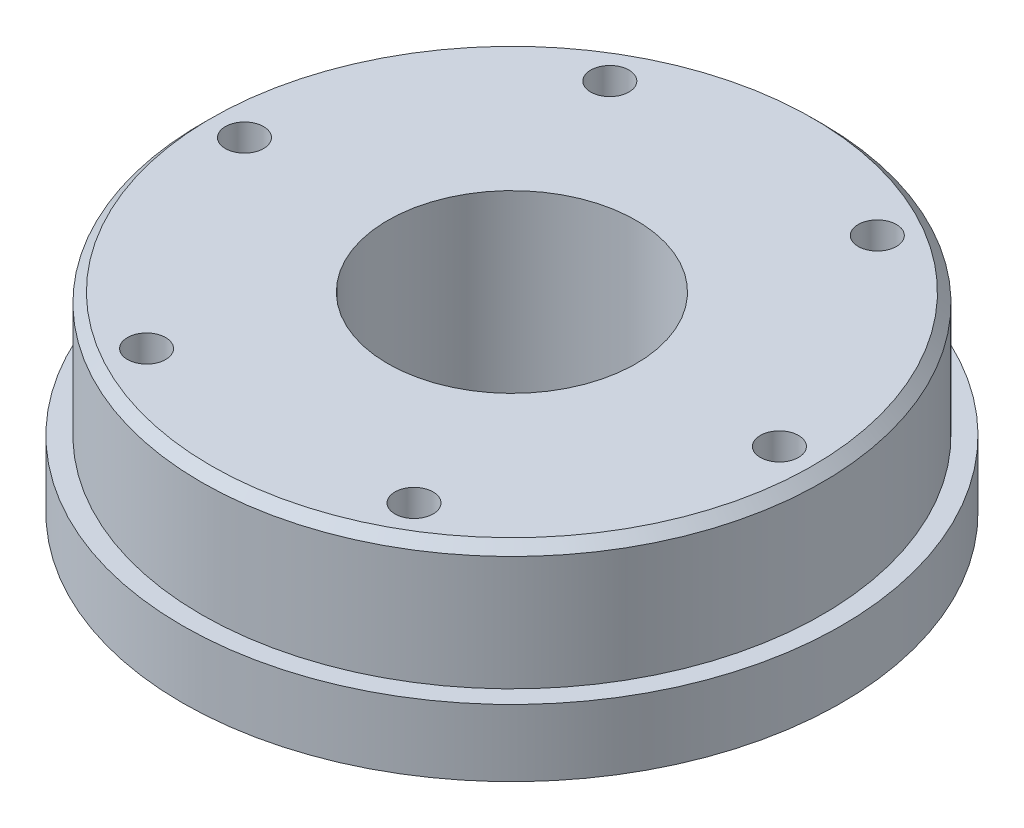
from build123d import *

# Parameters (mm, degrees)
SKETCH_1_R          = 34.5
EXTRUDE_1_DEPTH     = 20
CUT_EXTRUDE_START   = -13
SKETCH_2_R          = 34.5
SKETCH_2_R_2        = 32.5
CUT_EXTRUDE_1_DEPTH = 13
SKETCH_3_R          = 2
CUT_EXTRUDE_3_DEPTH = 53.730446613
SKETCH_7_R          = 13
CUT_EXTRUDE_6_DEPTH = 53.730446613
SKETCH_8_R          = 3.75
CUT_EXTRUDE_7_DEPTH = 4.5
CHAMFER_4_SIZE      = 1
SKETCH_9_R          = 2
CUT_EXTRUDE_8_DEPTH = 10


with BuildPart() as part:
    # 草图1 → 凸台-拉伸1 (new body)
    with BuildSketch(Plane(origin=(0, 0, 0), x_dir=(1, 0, 0), z_dir=(0, 1, 0))):
        Circle(SKETCH_1_R)
    extrude(amount=EXTRUDE_1_DEPTH)

    # 草图2 → 切除-拉伸1 (cut)
    with BuildSketch(Plane(origin=(0, 20, 0), x_dir=(1, 0, 0), z_dir=(0, 1, 0)).offset(CUT_EXTRUDE_START)):
        Circle(SKETCH_2_R)
        Circle(SKETCH_2_R_2, mode=Mode.SUBTRACT)
    extrude(amount=CUT_EXTRUDE_1_DEPTH, mode=Mode.SUBTRACT)

    # 草图3 → 切除-拉伸3 (cut, through all)
    with BuildSketch(Plane(origin=(0, 20, 0), x_dir=(1, 0, 0), z_dir=(0, 1, 0))):
        with Locations((-28, 0)):
            Circle(SKETCH_3_R)
        with Locations((-14, 24.248711306)):
            Circle(SKETCH_3_R)
        with Locations((14, 24.248711306)):
            Circle(SKETCH_3_R)
        with Locations((28, 0)):
            Circle(SKETCH_3_R)
        with Locations((14, -24.248711306)):
            Circle(SKETCH_3_R)
        with Locations((-14, -24.248711306)):
            Circle(SKETCH_3_R)
    extrude(amount=-CUT_EXTRUDE_3_DEPTH, mode=Mode.SUBTRACT)

    # 草图7 → 切除-拉伸6 (cut, through all)
    with BuildSketch(Plane(origin=(0, 20, 0), x_dir=(1, 0, 0), z_dir=(0, 1, 0))):
        Circle(SKETCH_7_R)
    extrude(amount=-CUT_EXTRUDE_6_DEPTH, mode=Mode.SUBTRACT)

    # 草图8 → 切除-拉伸7 (cut)
    with BuildSketch(Plane.XZ):
        with Locations((-28, 0)):
            Circle(SKETCH_8_R)
        with Locations((-14, 24.248711306)):
            Circle(SKETCH_8_R)
        with Locations((14, 24.248711306)):
            Circle(SKETCH_8_R)
        with Locations((28, 0)):
            Circle(SKETCH_8_R)
        with Locations((14, -24.248711306)):
            Circle(SKETCH_8_R)
        with Locations((-14, -24.248711306)):
            Circle(SKETCH_8_R)
    extrude(amount=-CUT_EXTRUDE_7_DEPTH, mode=Mode.SUBTRACT)

    # 倒角4
    chamfer_4_edges = [part.edges().sort_by_distance(p)[0] for p in [
        (-32.5, 20, 0),
    ]]
    chamfer(chamfer_4_edges, length=CHAMFER_4_SIZE)

    # 草图9 → 切除-拉伸8 (cut)
    with BuildSketch(Plane.XZ):
        with Locations((0, 28)):
            Circle(SKETCH_9_R)
        with Locations((24.248711306, 14)):
            Circle(SKETCH_9_R)
        with Locations((24.248711306, -14)):
            Circle(SKETCH_9_R)
        with Locations((0, -28)):
            Circle(SKETCH_9_R)
        with Locations((-24.248711306, -14)):
            Circle(SKETCH_9_R)
        with Locations((-24.248711306, 14)):
            Circle(SKETCH_9_R)
    extrude(amount=-CUT_EXTRUDE_8_DEPTH, mode=Mode.SUBTRACT)


solid = part.part
